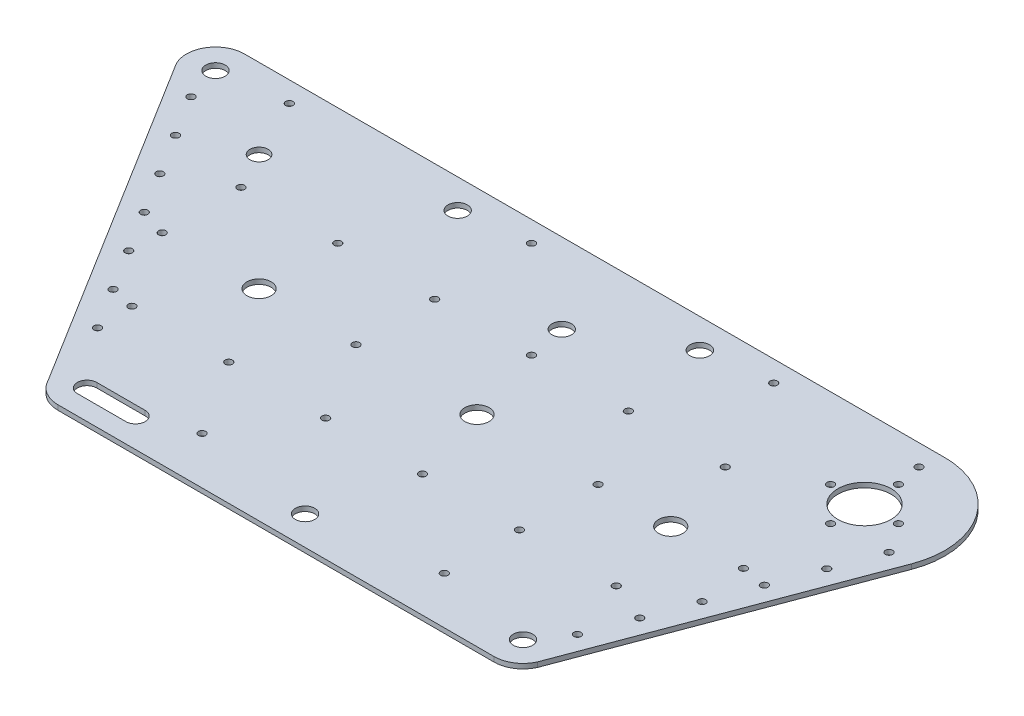
from build123d import *

# Parameters (mm, degrees)
BOSS_EXTRUDE1_DEPTH = 2


with BuildPart() as part:
    # Sketch1 → Boss-Extrude1 (new body)
    with BuildSketch(Plane(origin=(0, 0, 0), x_dir=(1, 0, 0), z_dir=(0, 1, 0))):
        with BuildLine():
            Line((182.961665791, 145.197671552), (-106.00519968, 144.943614194))
            add(Edge.make_bspline(
                [(-106.00519968, 144.943614194), (-127.679024036, 144.924558741), (-116.08546313, 126.611232779)],
                knots=[0.000879148, 0.000879148, 0.000879148, 2.135198153, 2.135198153, 2.135198153], degree=2, weights=[1, 0.482613975, 1]))
            Line((-116.08546313, 126.611232779), (-29.701931061, -12.425576557))
            add(Edge.make_bspline(
                [(-29.701931061, -12.425576557), (-26.369513305, -19.000000017), (-18.999049973, -19)],
                knots=[2.039949792, 2.039949792, 2.039949792, 3.141592656, 3.141592656, 3.141592656], degree=2, weights=[1, 0.852094883, 1]))
            Line((-18.999049973, -19), (160.991950179, -19))
            add(Edge.make_bspline(
                [(160.991950179, -19), (168.691832414, -18.999999885), (171.900116679, -12)],
                knots=[3.141592668, 3.141592668, 3.141592668, 4.282613549, 4.282613549, 4.282613549], degree=2, weights=[1, 0.841625416, 1]))
            Line((171.900116679, -12), (214.06903129, 100.332253713))
            add(Edge.make_bspline(
                [(214.06903129, 100.332253713), (230.926325183, 145.237792118), (182.96308424, 145.197672769)],
                knots=[4.353256006, 4.353256006, 4.353256006, 6.284014289, 6.284014289, 6.284014289], degree=2, weights=[1, 0.569095733, 0.999977608]))
            Line((182.96308424, 145.197672799), (182.961665791, 145.197671552))
        make_face()
        with BuildLine():
            add(Edge.make_bspline(
                [(-38.361920415, 18.171266638), (-40.959866722, 18.171266638), (-39.660893568, 15.921266638), (-38.361920415, 13.671266638), (-37.062947261, 15.921266638), (-35.763974107, 18.171266638), (-38.361920415, 18.171266638)],
                knots=[0, 0, 0, 2.094395102, 2.094395102, 4.188790205, 4.188790205, 6.283185307, 6.283185307, 6.283185307], degree=2, weights=[1, 0.5, 1, 0.5, 1, 0.5, 1]))
        make_face(mode=Mode.SUBTRACT)
        with BuildLine():
            add(Edge.make_bspline(
                [(-18.99905, -3), (-22.99885, -3), (-22.99885, -7), (-22.99885, -11), (-18.99905, -11)],
                knots=[3.141592654, 3.141592654, 3.141592654, 4.71238898, 4.71238898, 6.283185307, 6.283185307, 6.283185307], degree=2, weights=[1, 0.707106781, 1, 0.707106781, 1]))
            Line((-18.99905, -3), (0.99995, -3))
            add(Edge.make_bspline(
                [(0.99995, -11), (4.99975, -11), (4.99975, -7), (4.99975, -3), (0.99995, -3)],
                knots=[3.141592654, 3.141592654, 3.141592654, 4.71238898, 4.71238898, 6.283185307, 6.283185307, 6.283185307], degree=2, weights=[1, 0.707106781, 1, 0.707106781, 1]))
            Line((0.99995, -11), (-18.99905, -11))
        make_face(mode=Mode.SUBTRACT)
        with BuildLine():
            add(Edge.make_bspline(
                [(20.99895, 2), (18.401003692, 2), (19.699976846, -0.25), (20.99895, -2.5), (22.297923154, -0.25), (23.596896308, 2), (20.99895, 2)],
                knots=[0, 0, 0, 2.094395102, 2.094395102, 4.188790205, 4.188790205, 6.283185307, 6.283185307, 6.283185307], degree=2, weights=[1, 0.5, 1, 0.5, 1, 0.5, 1]))
        make_face(mode=Mode.SUBTRACT)
        with BuildLine():
            add(Edge.make_bspline(
                [(-38.99805, 32.999994311), (-41.595996308, 32.999994311), (-40.297023154, 30.749994311), (-38.99805, 28.499994311), (-37.699076846, 30.749994311), (-36.400103692, 32.999994311), (-38.99805, 32.999994311)],
                knots=[0, 0, 0, 2.094395102, 2.094395102, 4.188790205, 4.188790205, 6.283185307, 6.283185307, 6.283185307], degree=2, weights=[1, 0.5, 1, 0.5, 1, 0.5, 1]))
        make_face(mode=Mode.SUBTRACT)
        with BuildLine():
            add(Edge.make_bspline(
                [(-48.916261932, 35.158786529), (-51.51420824, 35.158786529), (-50.215235086, 32.908786529), (-48.916261932, 30.658786529), (-47.617288778, 32.908786529), (-46.318315625, 35.158786529), (-48.916261932, 35.158786529)],
                knots=[0, 0, 0, 2.094395102, 2.094395102, 4.188790205, 4.188790205, 6.283185307, 6.283185307, 6.283185307], degree=2, weights=[1, 0.5, 1, 0.5, 1, 0.5, 1]))
        make_face(mode=Mode.SUBTRACT)
        with BuildLine():
            add(Edge.make_bspline(
                [(-59.470762984, 52.146563195), (-62.068709292, 52.146563195), (-60.769736138, 49.896563195), (-59.470762984, 47.646563195), (-58.171789831, 49.896563195), (-56.872816677, 52.146563195), (-59.470762984, 52.146563195)],
                knots=[0, 0, 0, 2.094395102, 2.094395102, 4.188790205, 4.188790205, 6.283185307, 6.283185307, 6.283185307], degree=2, weights=[1, 0.5, 1, 0.5, 1, 0.5, 1]))
        make_face(mode=Mode.SUBTRACT)
        with BuildLine():
            add(Edge.make_bspline(
                [(0.99995, 32.999992415), (-1.597996308, 32.999992415), (-0.299023154, 30.749992415), (0.99995, 28.499992415), (2.298923154, 30.749992415), (3.597896308, 32.999992415), (0.99995, 32.999992415)],
                knots=[0, 0, 0, 2.094395102, 2.094395102, 4.188790205, 4.188790205, 6.283185307, 6.283185307, 6.283185307], degree=2, weights=[1, 0.5, 1, 0.5, 1, 0.5, 1]))
        make_face(mode=Mode.SUBTRACT)
        with BuildLine():
            add(Edge.make_bspline(
                [(40.99795, 32.999988622), (38.400003692, 32.999988622), (39.698976846, 30.749988622), (40.99795, 28.499988622), (42.296923154, 30.749988622), (43.595896308, 32.999988622), (40.99795, 32.999988622)],
                knots=[0, 0, 0, 2.094395102, 2.094395102, 4.188790205, 4.188790205, 6.283185307, 6.283185307, 6.283185307], degree=2, weights=[1, 0.5, 1, 0.5, 1, 0.5, 1]))
        make_face(mode=Mode.SUBTRACT)
        with BuildLine():
            add(Edge.make_bspline(
                [(70.99645, -3), (64.06859318, -3), (67.53252159, -9), (70.99645, -15), (74.46037841, -9), (77.92430682, -3), (70.99645, -3)],
                knots=[0, 0, 0, 2.094395102, 2.094395102, 4.188790205, 4.188790205, 6.283185307, 6.283185307, 6.283185307], degree=2, weights=[1, 0.5, 1, 0.5, 1, 0.5, 1]))
        make_face(mode=Mode.SUBTRACT)
        with BuildLine():
            add(Edge.make_bspline(
                [(120.99395, 2), (118.396003692, 2), (119.694976846, -0.25), (120.99395, -2.5), (122.292923154, -0.25), (123.591896308, 2), (120.99395, 2)],
                knots=[0, 0, 0, 2.094395102, 2.094395102, 4.188790205, 4.188790205, 6.283185307, 6.283185307, 6.283185307], degree=2, weights=[1, 0.5, 1, 0.5, 1, 0.5, 1]))
        make_face(mode=Mode.SUBTRACT)
        with BuildLine():
            add(Edge.make_bspline(
                [(160.99195, -3), (154.06409318, -3), (157.52802159, -9), (160.99195, -15), (164.45587841, -9), (167.91980682, -3), (160.99195, -3)],
                knots=[0, 0, 0, 2.094395102, 2.094395102, 4.188790205, 4.188790205, 6.283185307, 6.283185307, 6.283185307], degree=2, weights=[1, 0.5, 1, 0.5, 1, 0.5, 1]))
        make_face(mode=Mode.SUBTRACT)
        with BuildLine():
            add(Edge.make_bspline(
                [(170.332531489, 7.618627774), (167.734585182, 7.618627774), (169.033558335, 5.368627774), (170.332531489, 3.118627774), (171.631504643, 5.368627774), (172.930477797, 7.618627774), (170.332531489, 7.618627774)],
                knots=[0, 0, 0, 2.094395102, 2.094395102, 4.188790205, 4.188790205, 6.283185307, 6.283185307, 6.283185307], degree=2, weights=[1, 0.5, 1, 0.5, 1, 0.5, 1]))
        make_face(mode=Mode.SUBTRACT)
        with BuildLine():
            add(Edge.make_bspline(
                [(80.99595, 32.999985778), (78.398003692, 32.999985778), (79.696976846, 30.749985778), (80.99595, 28.499985778), (82.294923154, 30.749985778), (83.593896308, 32.999985778), (80.99595, 32.999985778)],
                knots=[0, 0, 0, 2.094395102, 2.094395102, 4.188790205, 4.188790205, 6.283185307, 6.283185307, 6.283185307], degree=2, weights=[1, 0.5, 1, 0.5, 1, 0.5, 1]))
        make_face(mode=Mode.SUBTRACT)
        with BuildLine():
            add(Edge.make_bspline(
                [(120.99395, 32.999981037), (118.396003692, 32.999981037), (119.694976846, 30.749981037), (120.99395, 28.499981037), (122.292923154, 30.749981037), (123.591896308, 32.999981037), (120.99395, 32.999981037)],
                knots=[0, 0, 0, 2.094395102, 2.094395102, 4.188790205, 4.188790205, 6.283185307, 6.283185307, 6.283185307], degree=2, weights=[1, 0.5, 1, 0.5, 1, 0.5, 1]))
        make_face(mode=Mode.SUBTRACT)
        with BuildLine():
            add(Edge.make_bspline(
                [(160.99195, 32.999978192), (158.394003692, 32.999978192), (159.692976846, 30.749978192), (160.99195, 28.499978192), (162.290923154, 30.749978192), (163.589896308, 32.999978192), (160.99195, 32.999978192)],
                knots=[0, 0, 0, 2.094395102, 2.094395102, 4.188790205, 4.188790205, 6.283185307, 6.283185307, 6.283185307], degree=2, weights=[1, 0.5, 1, 0.5, 1, 0.5, 1]))
        make_face(mode=Mode.SUBTRACT)
        with BuildLine():
            add(Edge.make_bspline(
                [(177.330672341, 26.354456596), (174.732726034, 26.354456596), (176.031699187, 24.104456596), (177.330672341, 21.854456596), (178.629645495, 24.104456596), (179.928618649, 26.354456596), (177.330672341, 26.354456596)],
                knots=[0, 0, 0, 2.094395102, 2.094395102, 4.188790205, 4.188790205, 6.283185307, 6.283185307, 6.283185307], degree=2, weights=[1, 0.5, 1, 0.5, 1, 0.5, 1]))
        make_face(mode=Mode.SUBTRACT)
        with BuildLine():
            add(Edge.make_bspline(
                [(184.328557385, 45.089600555), (181.730611078, 45.089600555), (183.029584232, 42.839600555), (184.328557385, 40.589600555), (185.627530539, 42.839600555), (186.926503693, 45.089600555), (184.328557385, 45.089600555)],
                knots=[0, 0, 0, 2.094395102, 2.094395102, 4.188790205, 4.188790205, 6.283185307, 6.283185307, 6.283185307], degree=2, weights=[1, 0.5, 1, 0.5, 1, 0.5, 1]))
        make_face(mode=Mode.SUBTRACT)
        with BuildLine():
            add(Edge.make_bspline(
                [(191.32646769, 63.824812144), (188.728521383, 63.824812144), (190.027494537, 61.574812144), (191.32646769, 59.324812144), (192.625440844, 61.574812144), (193.924413998, 63.824812144), (191.32646769, 63.824812144)],
                knots=[0, 0, 0, 2.094395102, 2.094395102, 4.188790205, 4.188790205, 6.283185307, 6.283185307, 6.283185307], degree=2, weights=[1, 0.5, 1, 0.5, 1, 0.5, 1]))
        make_face(mode=Mode.SUBTRACT)
        with BuildLine():
            add(Edge.make_bspline(
                [(-70.02547384, 69.134677545), (-72.623420147, 69.134677545), (-71.324446993, 66.884677545), (-70.02547384, 64.634677545), (-68.726500686, 66.884677545), (-67.427527532, 69.134677545), (-70.02547384, 69.134677545)],
                knots=[0, 0, 0, 2.094395102, 2.094395102, 4.188790205, 4.188790205, 6.283185307, 6.283185307, 6.283185307], degree=2, weights=[1, 0.5, 1, 0.5, 1, 0.5, 1]))
        make_face(mode=Mode.SUBTRACT)
        with BuildLine():
            add(Edge.make_bspline(
                [(-58.99705, 65.5), (-61.594996308, 65.5), (-60.296023154, 63.25), (-58.99705, 61), (-57.698076846, 63.25), (-56.399103692, 65.5), (-58.99705, 65.5)],
                knots=[0, 0, 0, 2.094395102, 2.094395102, 4.188790205, 4.188790205, 6.283185307, 6.283185307, 6.283185307], degree=2, weights=[1, 0.5, 1, 0.5, 1, 0.5, 1]))
        make_face(mode=Mode.SUBTRACT)
        with BuildLine():
            add(Edge.make_bspline(
                [(-91.134705429, 103.110600241), (-93.732651737, 103.110600241), (-92.433678583, 100.860600241), (-91.134705429, 98.610600241), (-89.835732276, 100.860600241), (-88.536759122, 103.110600241), (-91.134705429, 103.110600241)],
                knots=[0, 0, 0, 2.094395102, 2.094395102, 4.188790205, 4.188790205, 6.283185307, 6.283185307, 6.283185307], degree=2, weights=[1, 0.5, 1, 0.5, 1, 0.5, 1]))
        make_face(mode=Mode.SUBTRACT)
        with BuildLine():
            add(Edge.make_bspline(
                [(-80.580283096, 86.122950275), (-83.178229403, 86.122950275), (-81.87925625, 83.872950275), (-80.580283096, 81.622950275), (-79.281309942, 83.872950275), (-77.982336788, 86.122950275), (-80.580283096, 86.122950275)],
                knots=[0, 0, 0, 2.094395102, 2.094395102, 4.188790205, 4.188790205, 6.283185307, 6.283185307, 6.283185307], degree=2, weights=[1, 0.5, 1, 0.5, 1, 0.5, 1]))
        make_face(mode=Mode.SUBTRACT)
        with BuildLine():
            add(Edge.make_bspline(
                [(-58.99705, 98), (-61.594996308, 98), (-60.296023154, 95.75), (-58.99705, 93.5), (-57.698076846, 95.75), (-56.399103692, 98), (-58.99705, 98)],
                knots=[0, 0, 0, 2.094395102, 2.094395102, 4.188790205, 4.188790205, 6.283185307, 6.283185307, 6.283185307], degree=2, weights=[1, 0.5, 1, 0.5, 1, 0.5, 1]))
        make_face(mode=Mode.SUBTRACT)
        with BuildLine():
            add(Edge.make_bspline(
                [(-18.99905, 69), (-27.658871025, 69), (-23.328960513, 61.5), (-18.99905, 54), (-14.669139487, 61.5), (-10.339228975, 69), (-18.99905, 69)],
                knots=[0, 0, 0, 2.094395102, 2.094395102, 4.188790205, 4.188790205, 6.283185307, 6.283185307, 6.283185307], degree=2, weights=[1, 0.5, 1, 0.5, 1, 0.5, 1]))
        make_face(mode=Mode.SUBTRACT)
        with BuildLine():
            add(Edge.make_bspline(
                [(20.99895, 65.5), (18.401003692, 65.5), (19.699976846, 63.25), (20.99895, 61), (22.297923154, 63.25), (23.596896308, 65.5), (20.99895, 65.5)],
                knots=[0, 0, 0, 2.094395102, 2.094395102, 4.188790205, 4.188790205, 6.283185307, 6.283185307, 6.283185307], degree=2, weights=[1, 0.5, 1, 0.5, 1, 0.5, 1]))
        make_face(mode=Mode.SUBTRACT)
        with BuildLine():
            add(Edge.make_bspline(
                [(-18.99905, 98), (-21.596996308, 98), (-20.298023154, 95.75), (-18.99905, 93.5), (-17.700076846, 95.75), (-16.401103692, 98), (-18.99905, 98)],
                knots=[0, 0, 0, 2.094395102, 2.094395102, 4.188790205, 4.188790205, 6.283185307, 6.283185307, 6.283185307], degree=2, weights=[1, 0.5, 1, 0.5, 1, 0.5, 1]))
        make_face(mode=Mode.SUBTRACT)
        with BuildLine():
            add(Edge.make_bspline(
                [(20.99895, 98), (18.401003692, 98), (19.699976846, 95.75), (20.99895, 93.5), (22.297923154, 95.75), (23.596896308, 98), (20.99895, 98)],
                knots=[0, 0, 0, 2.094395102, 2.094395102, 4.188790205, 4.188790205, 6.283185307, 6.283185307, 6.283185307], degree=2, weights=[1, 0.5, 1, 0.5, 1, 0.5, 1]))
        make_face(mode=Mode.SUBTRACT)
        with BuildLine():
            add(Edge.make_bspline(
                [(-101.689209002, 120.098380963), (-104.287155309, 120.098380963), (-102.988182156, 117.848380963), (-101.689209002, 115.598380963), (-100.390235848, 117.848380963), (-99.091262694, 120.098380963), (-101.689209002, 120.098380963)],
                knots=[0, 0, 0, 2.094395102, 2.094395102, 4.188790205, 4.188790205, 6.283185307, 6.283185307, 6.283185307], degree=2, weights=[1, 0.5, 1, 0.5, 1, 0.5, 1]))
        make_face(mode=Mode.SUBTRACT)
        with BuildLine():
            add(Edge.make_bspline(
                [(-66.99665, 115.75), (-73.491515769, 115.75), (-70.244082884, 110.125), (-66.99665, 104.5), (-63.749217116, 110.125), (-60.501784231, 115.75), (-66.99665, 115.75)],
                knots=[0, 0, 0, 2.094395102, 2.094395102, 4.188790205, 4.188790205, 6.283185307, 6.283185307, 6.283185307], degree=2, weights=[1, 0.5, 1, 0.5, 1, 0.5, 1]))
        make_face(mode=Mode.SUBTRACT)
        with BuildLine():
            add(Edge.make_bspline(
                [(-105.9947, 137), (-112.92255682, 137), (-109.45862841, 131), (-105.9947, 125), (-102.53077159, 131), (-99.06684318, 137), (-105.9947, 137)],
                knots=[0, 0, 0, 2.094395102, 2.094395102, 4.188790205, 4.188790205, 6.283185307, 6.283185307, 6.283185307], degree=2, weights=[1, 0.5, 1, 0.5, 1, 0.5, 1]))
        make_face(mode=Mode.SUBTRACT)
        with BuildLine():
            add(Edge.make_bspline(
                [(-78.996040132, 138), (-81.59398644, 138), (-80.295013286, 135.75), (-78.996040132, 133.5), (-77.697066978, 135.75), (-76.398093824, 138), (-78.996040132, 138)],
                knots=[0, 0, 0, 2.094395102, 2.094395102, 4.188790205, 4.188790205, 6.283185307, 6.283185307, 6.283185307], degree=2, weights=[1, 0.5, 1, 0.5, 1, 0.5, 1]))
        make_face(mode=Mode.SUBTRACT)
        with BuildLine():
            add(Edge.make_bspline(
                [(-5.9997, 137), (-12.92755682, 137), (-9.46362841, 131), (-5.9997, 125), (-2.53577159, 131), (0.92815682, 137), (-5.9997, 137)],
                knots=[0, 0, 0, 2.094395102, 2.094395102, 4.188790205, 4.188790205, 6.283185307, 6.283185307, 6.283185307], degree=2, weights=[1, 0.5, 1, 0.5, 1, 0.5, 1]))
        make_face(mode=Mode.SUBTRACT)
        with BuildLine():
            add(Edge.make_bspline(
                [(20.99895, 138), (18.401003692, 138), (19.699976846, 135.75), (20.99895, 133.5), (22.297923154, 135.75), (23.596896308, 138), (20.99895, 138)],
                knots=[0, 0, 0, 2.094395102, 2.094395102, 4.188790205, 4.188790205, 6.283185307, 6.283185307, 6.283185307], degree=2, weights=[1, 0.5, 1, 0.5, 1, 0.5, 1]))
        make_face(mode=Mode.SUBTRACT)
        with BuildLine():
            add(Edge.make_bspline(
                [(70.99645, 69), (62.336628975, 69), (66.666539487, 61.5), (70.99645, 54), (75.326360513, 61.5), (79.656271025, 69), (70.99645, 69)],
                knots=[0, 0, 0, 2.094395102, 2.094395102, 4.188790205, 4.188790205, 6.283185307, 6.283185307, 6.283185307], degree=2, weights=[1, 0.5, 1, 0.5, 1, 0.5, 1]))
        make_face(mode=Mode.SUBTRACT)
        with BuildLine():
            add(Edge.make_bspline(
                [(120.99395, 65.5), (118.396003692, 65.5), (119.694976846, 63.25), (120.99395, 61), (122.292923154, 63.25), (123.591896308, 65.5), (120.99395, 65.5)],
                knots=[0, 0, 0, 2.094395102, 2.094395102, 4.188790205, 4.188790205, 6.283185307, 6.283185307, 6.283185307], degree=2, weights=[1, 0.5, 1, 0.5, 1, 0.5, 1]))
        make_face(mode=Mode.SUBTRACT)
        with BuildLine():
            add(Edge.make_bspline(
                [(60.99695, 98), (58.399003692, 98), (59.697976846, 95.75), (60.99695, 93.5), (62.295923154, 95.75), (63.594896308, 98), (60.99695, 98)],
                knots=[0, 0, 0, 2.094395102, 2.094395102, 4.188790205, 4.188790205, 6.283185307, 6.283185307, 6.283185307], degree=2, weights=[1, 0.5, 1, 0.5, 1, 0.5, 1]))
        make_face(mode=Mode.SUBTRACT)
        with BuildLine():
            add(Edge.make_bspline(
                [(100.99495, 98), (98.397003692, 98), (99.695976846, 95.75), (100.99495, 93.5), (102.293923154, 95.75), (103.592896308, 98), (100.99495, 98)],
                knots=[0, 0, 0, 2.094395102, 2.094395102, 4.188790205, 4.188790205, 6.283185307, 6.283185307, 6.283185307], degree=2, weights=[1, 0.5, 1, 0.5, 1, 0.5, 1]))
        make_face(mode=Mode.SUBTRACT)
        with BuildLine():
            add(Edge.make_bspline(
                [(140.99295, 98), (138.395003692, 98), (139.693976846, 95.75), (140.99295, 93.5), (142.291923154, 95.75), (143.590896308, 98), (140.99295, 98)],
                knots=[0, 0, 0, 2.094395102, 2.094395102, 4.188790205, 4.188790205, 6.283185307, 6.283185307, 6.283185307], degree=2, weights=[1, 0.5, 1, 0.5, 1, 0.5, 1]))
        make_face(mode=Mode.SUBTRACT)
        with BuildLine():
            add(Edge.make_bspline(
                [(150.99245, 69), (142.332628975, 69), (146.662539487, 61.5), (150.99245, 54), (155.322360513, 61.5), (159.652271025, 69), (150.99245, 69)],
                knots=[0, 0, 0, 2.094395102, 2.094395102, 4.188790205, 4.188790205, 6.283185307, 6.283185307, 6.283185307], degree=2, weights=[1, 0.5, 1, 0.5, 1, 0.5, 1]))
        make_face(mode=Mode.SUBTRACT)
        with BuildLine():
            add(Edge.make_bspline(
                [(180.99095, 65.5), (178.393003692, 65.5), (179.691976846, 63.25), (180.99095, 61), (182.289923154, 63.25), (183.588896308, 65.5), (180.99095, 65.5)],
                knots=[0, 0, 0, 2.094395102, 2.094395102, 4.188790205, 4.188790205, 6.283185307, 6.283185307, 6.283185307], degree=2, weights=[1, 0.5, 1, 0.5, 1, 0.5, 1]))
        make_face(mode=Mode.SUBTRACT)
        with BuildLine():
            add(Edge.make_bspline(
                [(198.324441471, 82.560193672), (195.726495163, 82.560193672), (197.025468317, 80.310193672), (198.324441471, 78.060193672), (199.623414624, 80.310193672), (200.922387778, 82.560193672), (198.324441471, 82.560193672)],
                knots=[0, 0, 0, 2.094395102, 2.094395102, 4.188790205, 4.188790205, 6.283185307, 6.283185307, 6.283185307], degree=2, weights=[1, 0.5, 1, 0.5, 1, 0.5, 1]))
        make_face(mode=Mode.SUBTRACT)
        with BuildLine():
            add(Edge.make_bspline(
                [(182.99085, 99.5), (180.392903692, 99.5), (181.691876846, 97.25), (182.99085, 95), (184.289823154, 97.25), (185.588796308, 99.5), (182.99085, 99.5)],
                knots=[0, 0, 0, 2.094395102, 2.094395102, 4.188790205, 4.188790205, 6.283185307, 6.283185307, 6.283185307], degree=2, weights=[1, 0.5, 1, 0.5, 1, 0.5, 1]))
        make_face(mode=Mode.SUBTRACT)
        with BuildLine():
            add(Edge.make_bspline(
                [(205.322481122, 101.295751553), (202.724534814, 101.295751553), (204.023507968, 99.045751553), (205.322481122, 96.795751553), (206.621454275, 99.045751553), (207.920427429, 101.295751553), (205.322481122, 101.295751553)],
                knots=[0, 0, 0, 2.094395102, 2.094395102, 4.188790205, 4.188790205, 6.283185307, 6.283185307, 6.283185307], degree=2, weights=[1, 0.5, 1, 0.5, 1, 0.5, 1]))
        make_face(mode=Mode.SUBTRACT)
        with BuildLine():
            add(Edge.make_bspline(
                [(57.9971, 116), (51.06924318, 116), (54.53317159, 110), (57.9971, 104), (61.46102841, 110), (64.92495682, 116), (57.9971, 116)],
                knots=[0, 0, 0, 2.094395102, 2.094395102, 4.188790205, 4.188790205, 6.283185307, 6.283185307, 6.283185307], degree=2, weights=[1, 0.5, 1, 0.5, 1, 0.5, 1]))
        make_face(mode=Mode.SUBTRACT)
        with BuildLine():
            add(Edge.make_bspline(
                [(93.995220809, 137), (87.067363989, 137), (90.531292399, 131), (93.995220809, 125), (97.459149219, 131), (100.923077629, 137), (93.995220809, 137)],
                knots=[0, 0, 0, 2.094395102, 2.094395102, 4.188790205, 4.188790205, 6.283185307, 6.283185307, 6.283185307], degree=2, weights=[1, 0.5, 1, 0.5, 1, 0.5, 1]))
        make_face(mode=Mode.SUBTRACT)
        with BuildLine():
            add(Edge.make_bspline(
                [(120.99395, 138), (118.396003692, 138), (119.694976846, 135.75), (120.99395, 133.5), (122.292923154, 135.75), (123.591896308, 138), (120.99395, 138)],
                knots=[0, 0, 0, 2.094395102, 2.094395102, 4.188790205, 4.188790205, 6.283185307, 6.283185307, 6.283185307], degree=2, weights=[1, 0.5, 1, 0.5, 1, 0.5, 1]))
        make_face(mode=Mode.SUBTRACT)
        with BuildLine():
            add(Edge.make_bspline(
                [(168.99155, 113.5), (166.393603692, 113.5), (167.692576846, 111.25), (168.99155, 109), (170.290523154, 111.25), (171.589496308, 113.5), (168.99155, 113.5)],
                knots=[0, 0, 0, 2.094395102, 2.094395102, 4.188790205, 4.188790205, 6.283185307, 6.283185307, 6.283185307], degree=2, weights=[1, 0.5, 1, 0.5, 1, 0.5, 1]))
        make_face(mode=Mode.SUBTRACT)
        with BuildLine():
            add(Edge.make_bspline(
                [(182.99085, 123), (163.939243745, 123), (173.465046872, 106.5), (182.99085, 90), (192.516653128, 106.5), (202.042456255, 123), (182.99085, 123)],
                knots=[0, 0, 0, 2.094395102, 2.094395102, 4.188790205, 4.188790205, 6.283185307, 6.283185307, 6.283185307], degree=2, weights=[1, 0.5, 1, 0.5, 1, 0.5, 1]))
        make_face(mode=Mode.SUBTRACT)
        with BuildLine():
            add(Edge.make_bspline(
                [(196.99015, 113.5), (194.392203692, 113.5), (195.691176846, 111.25), (196.99015, 109), (198.289123154, 111.25), (199.588096308, 113.5), (196.99015, 113.5)],
                knots=[0, 0, 0, 2.094395102, 2.094395102, 4.188790205, 4.188790205, 6.283185307, 6.283185307, 6.283185307], degree=2, weights=[1, 0.5, 1, 0.5, 1, 0.5, 1]))
        make_face(mode=Mode.SUBTRACT)
        with BuildLine():
            add(Edge.make_bspline(
                [(182.99085, 127.5), (180.392903692, 127.5), (181.691876846, 125.25), (182.99085, 123), (184.289823154, 125.25), (185.588796308, 127.5), (182.99085, 127.5)],
                knots=[0, 0, 0, 2.094395102, 2.094395102, 4.188790205, 4.188790205, 6.283185307, 6.283185307, 6.283185307], degree=2, weights=[1, 0.5, 1, 0.5, 1, 0.5, 1]))
        make_face(mode=Mode.SUBTRACT)
        with BuildLine():
            add(Edge.make_bspline(
                [(180.99095, 138), (178.393003692, 138), (179.691976846, 135.75), (180.99095, 133.5), (182.289923154, 135.75), (183.588896308, 138), (180.99095, 138)],
                knots=[0, 0, 0, 2.094395102, 2.094395102, 4.188790205, 4.188790205, 6.283185307, 6.283185307, 6.283185307], degree=2, weights=[1, 0.5, 1, 0.5, 1, 0.5, 1]))
        make_face(mode=Mode.SUBTRACT)
    extrude(amount=BOSS_EXTRUDE1_DEPTH)


solid = part.part
